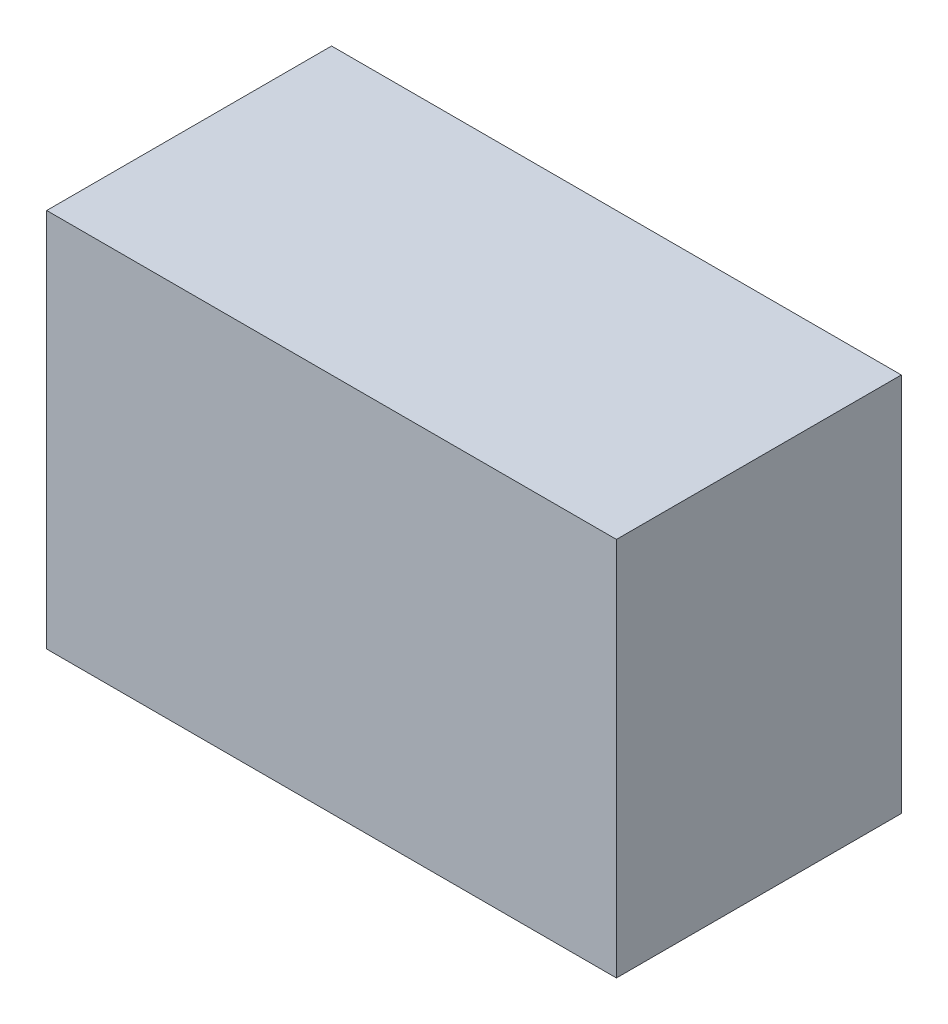
from build123d import *

# Parameters (mm, degrees)
SKETCH_1_W      = 6
SKETCH_1_H      = 4
EXTRUDE_1_DEPTH = 3


with BuildPart() as part:
    # ｽｹｯﾁ1 → ﾎﾞｽ - 押し出し1 (new body)
    with BuildSketch(Plane.XY):
        with Locations((3, 2)):
            Rectangle(SKETCH_1_W, SKETCH_1_H)
    extrude(amount=EXTRUDE_1_DEPTH)


solid = part.part
